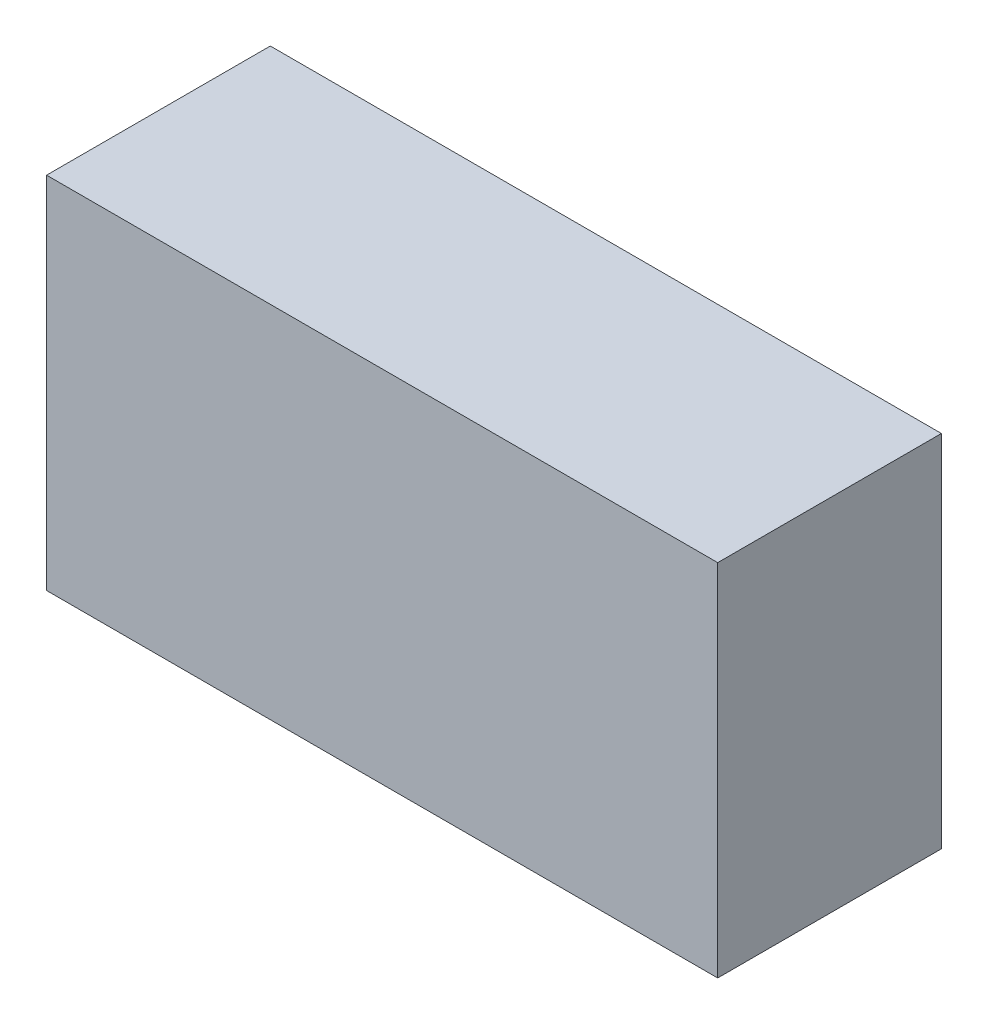
from build123d import *

# Parameters (mm, degrees)
SKETCH1_W           = 50
SKETCH1_H           = 80.4
BOSS_EXTRUDE1_DEPTH = 75


with BuildPart() as part:
    # Sketch1 → Boss-Extrude1 (new, symmetric)
    with BuildSketch(Plane(origin=(0, 0, 0), x_dir=(0, 0, -1), z_dir=(1, 0, 0))):
        with Locations((-25, -40.2)):
            Rectangle(SKETCH1_W, SKETCH1_H)
    extrude(amount=BOSS_EXTRUDE1_DEPTH, both=True)


solid = part.part
